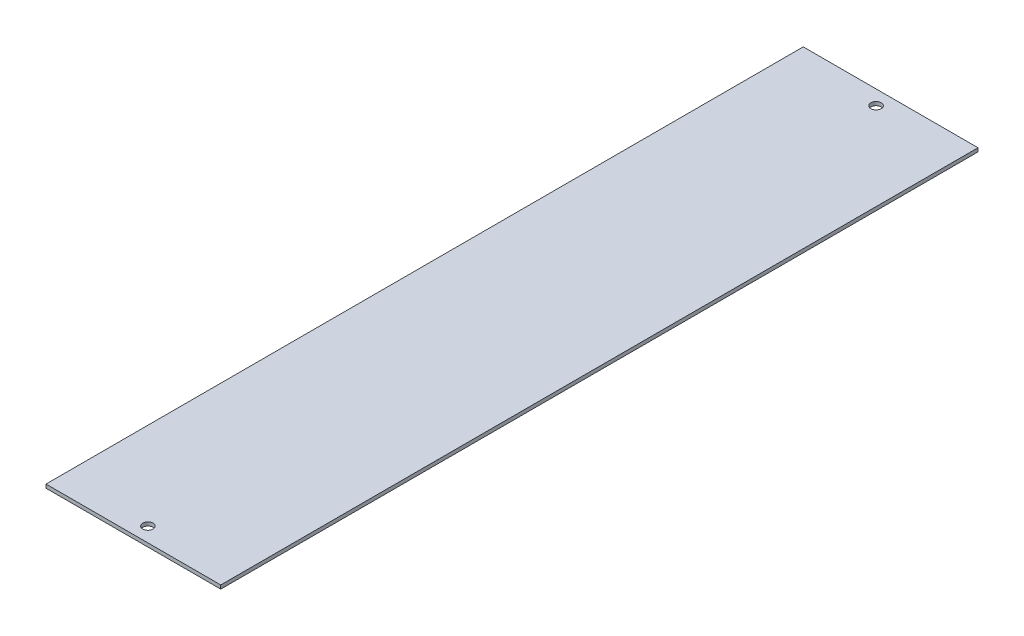
from build123d import *

# Parameters (mm, degrees)
SKETCH1_W           = 76.2
SKETCH1_H           = 330.2
SKETCH1_R           = 2.25
BOSS_EXTRUDE1_DEPTH = 1.5875


with BuildPart() as part:
    # Sketch1 → Boss-Extrude1 (new body)
    with BuildSketch(Plane(origin=(0, 0, 0), x_dir=(1, 0, 0), z_dir=(0, 1, 0))):
        with Locations((-38.1, -165.1)):
            Rectangle(SKETCH1_W, SKETCH1_H)
        with Locations(Location((-38.1, -6.35, 0), (0, 0, 270))):
            Circle(SKETCH1_R, mode=Mode.SUBTRACT)
        with Locations(Location((-38.1, -323.85, 0), (0, 0, 270))):
            Circle(SKETCH1_R, mode=Mode.SUBTRACT)
    extrude(amount=BOSS_EXTRUDE1_DEPTH)


solid = part.part
